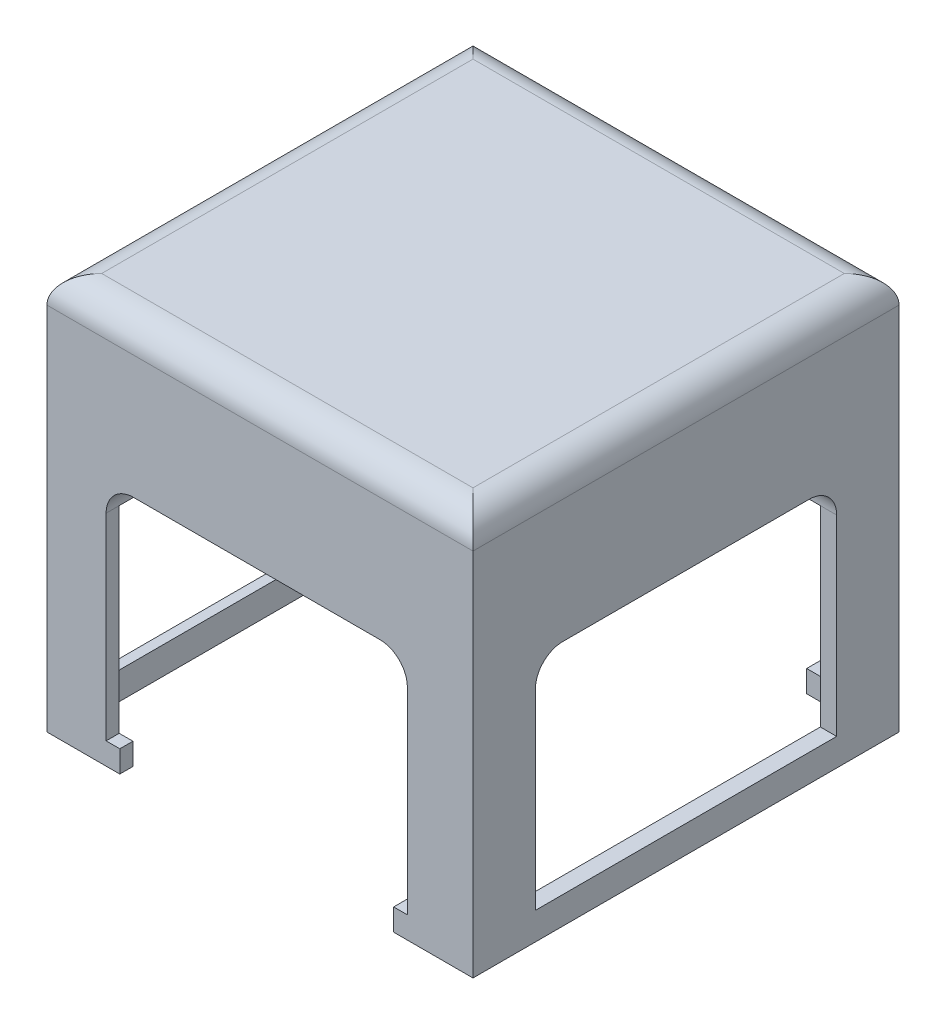
from build123d import *

# Parameters (mm, degrees)
SKETCH1_W           = 155.58
SKETCH1_H           = 155.58
BOSS_EXTRUDE1_DEPTH = 145
CUT_EXTRUDE1_REACH  = 228.454
CUT_EXTRUDE2_DEPTH  = 155.8
SKETCH4_W           = 18
SKETCH4_H           = 18
CUT_EXTRUDE3_DEPTH  = 80
FILLET1_R           = 10
SKETCH5_W           = 18
SKETCH5_H           = 110
CUT_EXTRUDE4_DEPTH  = 10
SKETCH6_W           = 110
SKETCH6_H           = 146
CUT_EXTRUDE5_DEPTH  = 10


with BuildPart() as part:
    # Sketch1 → Boss-Extrude1 (new body)
    with BuildSketch(Plane(origin=(0, 0, 0), x_dir=(1, 0, 0), z_dir=(0, 1, 0))):
        Rectangle(SKETCH1_W, SKETCH1_H)
    extrude(amount=BOSS_EXTRUDE1_DEPTH)

    # Sketch2 → Cut-Extrude1 (cut, up to next)
    with BuildSketch(Plane.XY.offset(77.79), mode=Mode.PRIVATE) as cut_extrude1_sk1:
        with BuildLine():
            Line((43.823001254, 90), (-46.176998746, 90))
            ThreePointArc((-46.176998746, 90), (-53.248066558, 87.071067812), (-56.176998746, 80))
            Line((-56.176998746, 80), (-56.176998746, 8))
            Line((-56.176998746, 8), (-51.176998746, 8))
            Line((-51.176998746, 8), (-51.176998746, 0))
            Line((-51.176998746, 0), (48.823001254, 0))
            Line((48.823001254, 0), (48.823001254, 8))
            Line((48.823001254, 8), (53.823001254, 8))
            Line((53.823001254, 8), (53.823001254, 80))
            ThreePointArc((53.823001254, 80), (50.894069065, 87.071067812), (43.823001254, 90))
        make_face()
    cut_extrude1_tool1 = extrude(cut_extrude1_sk1.sketch, amount=-CUT_EXTRUDE1_REACH, mode=Mode.PRIVATE) & part.part
    add(cut_extrude1_tool1.solids().sort_by_distance((-1.176999, 45.147739, 77.79))[0], mode=Mode.SUBTRACT)

    # Sketch3 → Cut-Extrude2 (cut)
    with BuildSketch(Plane(origin=(77.79, 0, 0), x_dir=(0, 0, -1), z_dir=(1, 0, 0))):
        with BuildLine():
            Line((-55, 80), (-55, 10))
            Line((-55, 10), (55, 10))
            Line((55, 10), (55, 80))
            ThreePointArc((55, 80), (52.071067812, 87.071067812), (45, 90))
            Line((45, 90), (-45, 90))
            ThreePointArc((-45, 90), (-52.071067812, 87.071067812), (-55, 80))
        make_face()
    extrude(amount=-CUT_EXTRUDE2_DEPTH, mode=Mode.SUBTRACT)

    # Sketch4 → Cut-Extrude3 (cut)
    with BuildSketch(Plane.XZ):
        with Locations((62.823001254, -64)):
            Rectangle(SKETCH4_W, SKETCH4_H)
        with Locations((-65.176998746, -64)):
            Rectangle(SKETCH4_W, SKETCH4_H)
        with Locations((62.823001254, 64)):
            Rectangle(SKETCH4_W, SKETCH4_H)
        with Locations((-65.176998746, 64)):
            Rectangle(SKETCH4_W, SKETCH4_H)
    extrude(amount=-CUT_EXTRUDE3_DEPTH, mode=Mode.SUBTRACT)

    # Fillet1
    fillet1_edges = [part.edges().sort_by_distance(p)[0] for p in [
        (-77.79, 145, 0),
        (0, 145, 77.79),
        (77.79, 145, 0),
        (0, 145, -77.79),
    ]]
    fillet(fillet1_edges, radius=FILLET1_R)

    # Sketch5 → Cut-Extrude4 (cut)
    with BuildSketch(Plane.XZ):
        with Locations((-65.176998746, 0)):
            Rectangle(SKETCH5_W, SKETCH5_H)
        with Locations((62.823001254, 0)):
            Rectangle(SKETCH5_W, SKETCH5_H)
    extrude(amount=-CUT_EXTRUDE4_DEPTH, mode=Mode.SUBTRACT)

    # Sketch6 → Cut-Extrude5 (cut)
    with BuildSketch(Plane.XZ):
        with Locations((-1.176998746, 0)):
            Rectangle(SKETCH6_W, SKETCH6_H)
    extrude(amount=-CUT_EXTRUDE5_DEPTH, mode=Mode.SUBTRACT)


solid = part.part
